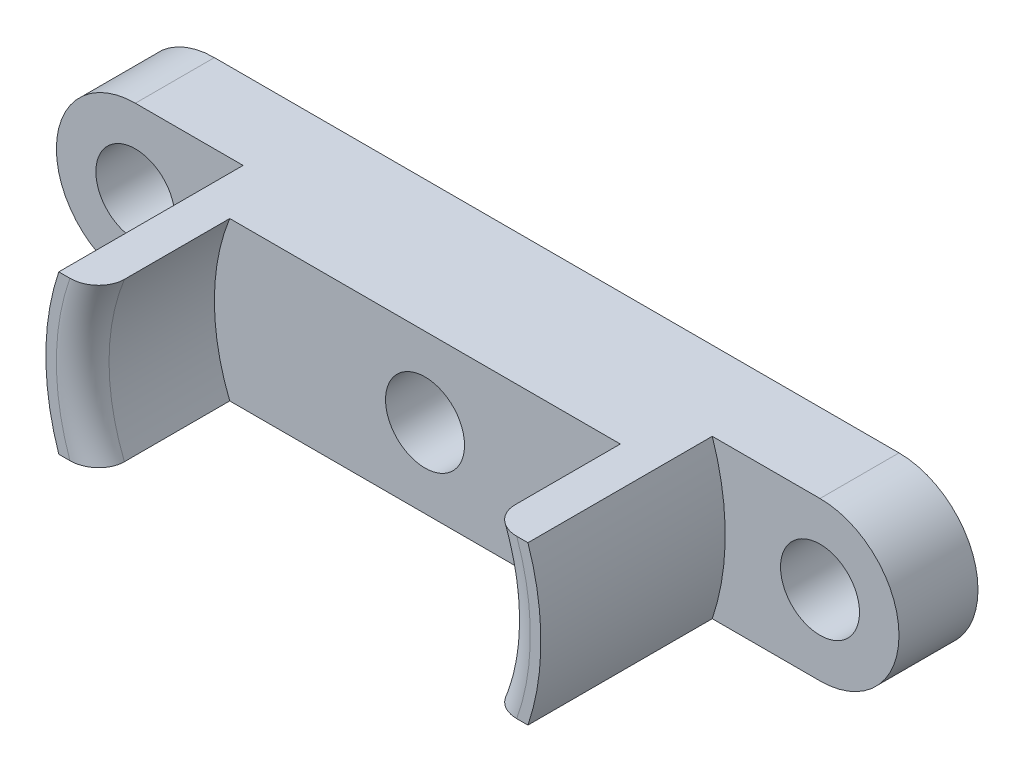
from build123d import *

# Parameters (mm, degrees)
SKETCH_2_W          = 49.66242786768973
SKETCH_2_H          = 43.948008528228435
CUT_EXTRUDE_1_DEPTH = 10
SKETCH_3_R          = 1.5
SKETCH_3_R_2        = 1.5000000000000007
SKETCH_3_R_3        = 1.5000000000000004
CUT_EXTRUDE_2_DEPTH = 18.029386365926428
EXTRUDE_START       = 5
EXTRUDE_2_DEPTH     = 5
FILLET_2_R          = 1


with BuildPart() as part:
    # 草图1 → 旋转3 (revolve)
    with BuildSketch(Plane(origin=(0, 0, 0), x_dir=(1, 0, 0), z_dir=(0, 1, 0)), mode=Mode.PRIVATE) as revolve_3_sk:
        Polygon((0, 0), (0, 5.000000000000001), (20, 5.000000000000001), (20, 2.0000000000000018), (9.4, 2.0000000000000004), (9.4, 2.6e-16), align=None)
    revolve(revolve_3_sk.sketch.rotate(Axis((0, 0, 0), (0, 0, 1)), 180), axis=Axis((0, 0, 0), (0, 0, 1)))

    # 草图2 → 切除-拉伸1 (cut)
    with BuildSketch(Plane.XY):
        Rectangle(SKETCH_2_W, SKETCH_2_H)
        with BuildLine():
            Line((13, -2.999999999999997), (-13, -3))
            ThreePointArc((-13, -3), (-16, 3.7e-16), (-13, 3))
            Line((-13, 3), (13, 3.000000000000003))
            ThreePointArc((13, 3.000000000000003), (16, 3.18e-15), (13, -2.999999999999997))
        make_face(mode=Mode.SUBTRACT)
    extrude(amount=-CUT_EXTRUDE_1_DEPTH, mode=Mode.SUBTRACT)

    # 草图3 → 切除-拉伸2 (cut, through all)
    with BuildSketch(Plane.XY):
        Circle(SKETCH_3_R)
        with Locations((12.999999999999998, 0)):
            Circle(SKETCH_3_R_2)
        with Locations((-13.000000000000002, 0)):
            Circle(SKETCH_3_R_3)
    extrude(amount=-CUT_EXTRUDE_2_DEPTH, mode=Mode.SUBTRACT)

    # 草图5 → 凸台-拉伸2 (add)
    with BuildSketch(Plane.XY.offset(EXTRUDE_START)):
        with BuildLine():
            Line((-7.416198487095722, 3.0000000000000004), (-8.908422980528035, 3.0000000000000004))
            ThreePointArc((-8.908422980528037, 3.000000000000001), (-9.400000000000002, 5.6e-16), (-8.90842298052804, -3))
            Line((-8.908422980528037, -2.9999999999999996), (-7.416198487095721, -2.9999999999999996))
            ThreePointArc((-7.416198487095696, -2.9999999999999187), (-8, 9.8e-16), (-7.416198487095695, 2.9999999999999205))
        make_face()
        with BuildLine():
            Line((8.908422980528035, 3.000000000000002), (7.41619848709553, 3.000000000000002))
            ThreePointArc((7.416198487095587, 3.000000000000189), (7.852693419991789, 1.5281380996551506), (8, 0))
            ThreePointArc((8, -1.96e-15), (7.85269341999179, -1.5281380996551457), (7.416198487095591, -3.0000000000001785))
            Line((7.416198487095535, -2.999999999999998), (8.908422980528037, -2.999999999999998))
            ThreePointArc((8.908422980528037, -2.999999999999998), (9.400000000000002, 1.67e-15), (8.908422980528037, 3.0000000000000018))
        make_face()
    extrude(amount=-EXTRUDE_2_DEPTH)

    # 圆角2
    fillet_2_edges = [part.edges().sort_by_distance(p)[0] for p in [
        (-8.000000000000002, 1.22e-15, 5),
        (8, 6.72e-15, 5),
    ]]
    fillet(fillet_2_edges, radius=FILLET_2_R)


solid = part.part
